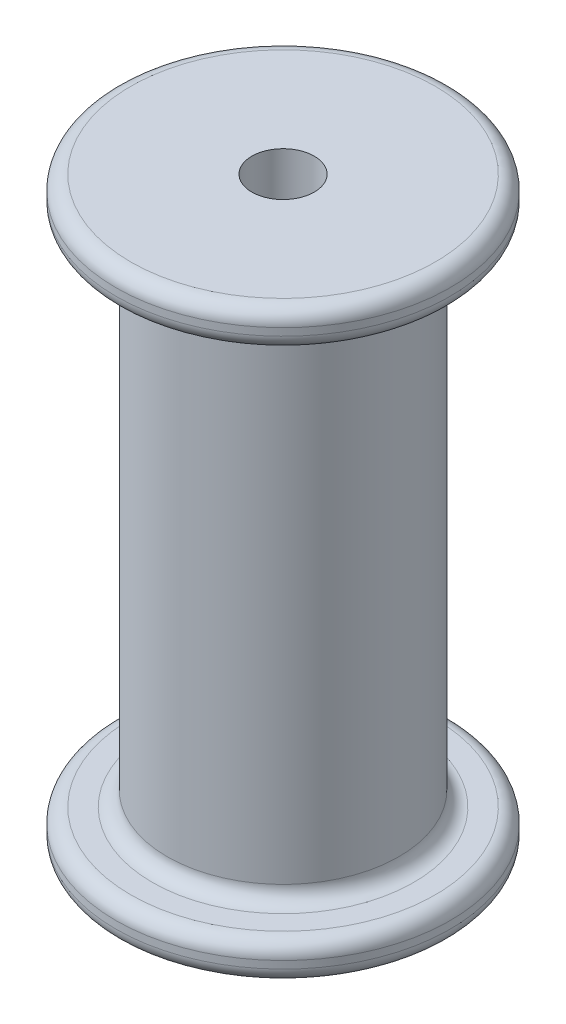
from build123d import *

# Parameters (mm, degrees)
SKETCH2_R           = 9.906
SKETCH2_R_2         = 2.667
BOSS_EXTRUDE1_DEPTH = 50.038
BOSS_EXTRUDE2_START = -3.175
SKETCH3_R           = 14.2875
SKETCH3_R_2         = 2.667
BOSS_EXTRUDE2_DEPTH = 3.175
BOSS_EXTRUDE3_START = -50.038
SKETCH3_2_R         = 14.2875
SKETCH3_2_R_2       = 2.667
BOSS_EXTRUDE3_DEPTH = 3.175
FILLET1_R           = 1.27


with BuildPart() as part:
    # Sketch2 → Boss-Extrude1 (new body)
    with BuildSketch(Plane(origin=(0, 0, 0), x_dir=(1, 0, 0), z_dir=(0, 1, 0))):
        with Locations(Location((0, 0, 0), (0, 0, 270))):
            Circle(SKETCH2_R)
        with Locations(Location((0, 0, 0), (0, 0, 270))):
            Circle(SKETCH2_R_2, mode=Mode.SUBTRACT)
    extrude(amount=BOSS_EXTRUDE1_DEPTH)

    # Sketch3 → Boss-Extrude2 (add)
    with BuildSketch(Plane(origin=(0, 50.038, 0), x_dir=(1, 0, 0), z_dir=(0, 1, 0)).offset(BOSS_EXTRUDE2_START)):
        with Locations(Location((0, 0, 0), (0, 0, 270))):
            Circle(SKETCH3_R)
        with Locations(Location((0, 0, 0), (0, 0, 270))):
            Circle(SKETCH3_R_2, mode=Mode.SUBTRACT)
    extrude(amount=BOSS_EXTRUDE2_DEPTH)

    # Sketch3<2> → Boss-Extrude3 (add)
    with BuildSketch(Plane(origin=(0, 50.038, 0), x_dir=(1, 0, 0), z_dir=(0, 1, 0)).offset(BOSS_EXTRUDE3_START)):
        with Locations(Location((0, 0, 0), (0, 0, 270))):
            Circle(SKETCH3_2_R)
        with Locations(Location((0, 0, 0), (0, 0, 270))):
            Circle(SKETCH3_2_R_2, mode=Mode.SUBTRACT)
    extrude(amount=BOSS_EXTRUDE3_DEPTH)

    # Fillet1
    fillet1_edges = [part.edges().sort_by_distance(p)[0] for p in [
        (0, 46.863, -9.906),
        (0, 50.038, -14.2875),
        (0, 46.863, -14.2875),
        (0, 3.175, -14.2875),
        (0, 3.175, -9.906),
        (0, 0, -14.2875),
    ]]
    fillet(fillet1_edges, radius=FILLET1_R)


solid = part.part
